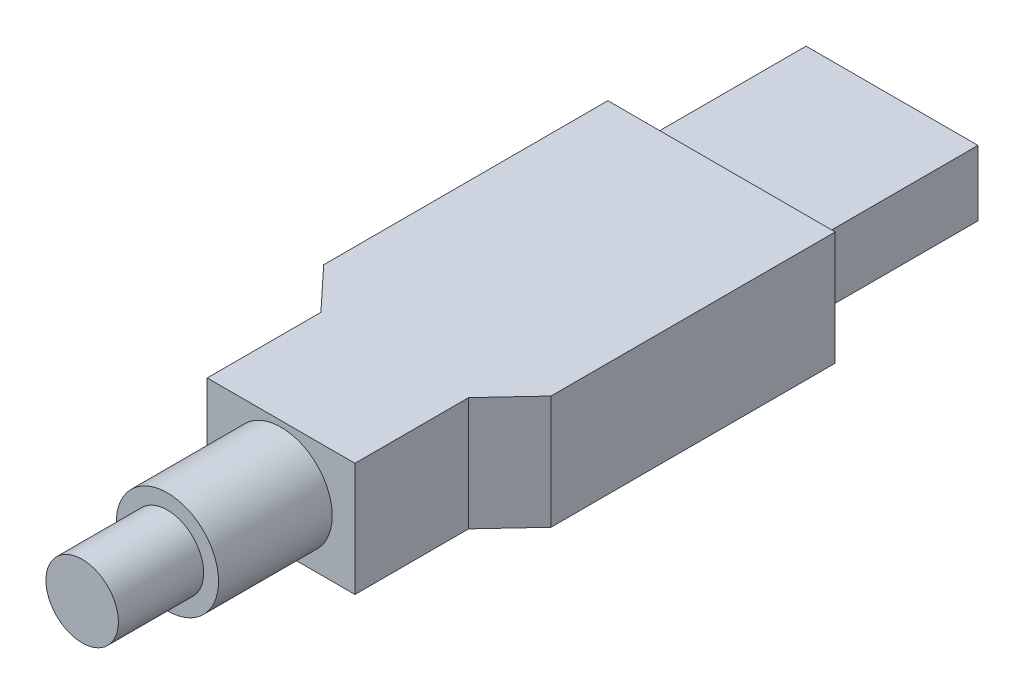
from build123d import *

# Parameters (mm, degrees)
ESQUISSE1_W             = 12.1
ESQUISSE1_H             = 4.6
BOSS_EXTRU_1_DEPTH      = 12
ESQUISSE3_W             = 11.5
ESQUISSE3_H             = 2.3
ENL_V_MAT_EXTRU_1_DEPTH = 9.6
ESQUISSE2_W             = 16
ESQUISSE2_H             = 8
BOSS_EXTRU_2_DEPTH      = 31
ENL_V_MAT_EXTRU_2_DEPTH = 45.463468151
ESQUISSE5_R             = 3.6
BOSS_EXTRU_3_DEPTH      = 8
ESQUISSE6_R             = 2.55
BOSS_EXTRU_4_DEPTH      = 6


with BuildPart() as part:
    # Esquisse1 → Boss.-Extru.1 (new body)
    with BuildSketch(Plane.XY):
        Rectangle(ESQUISSE1_W, ESQUISSE1_H)
    extrude(amount=BOSS_EXTRU_1_DEPTH)

    # Esquisse3 → Enlèv. mat.-Extru.1 (cut)
    with BuildSketch(Plane(origin=(0, 0, 0), x_dir=(-1, 0, 0), z_dir=(0, 0, -1))):
        with Locations((0, -0.85)):
            Rectangle(ESQUISSE3_W, ESQUISSE3_H)
    extrude(amount=-ENL_V_MAT_EXTRU_1_DEPTH, mode=Mode.SUBTRACT)

    # Esquisse2 → Boss.-Extru.2 (add)
    with BuildSketch(Plane.XY.offset(12)):
        Rectangle(ESQUISSE2_W, ESQUISSE2_H)
    extrude(amount=BOSS_EXTRU_2_DEPTH)

    # Esquisse4 → Enlèv. mat.-Extru.2 (cut, through all)
    with BuildSketch(Plane(origin=(0, 4, 0), x_dir=(1, 0, 0), z_dir=(0, 1, 0))):
        Polygon((-8, -43), (-8, -32), (-5.2, -35), (-5.2, -43), align=None)
        Polygon((5.2, -43), (8, -43), (8, -32), (5.2, -35), align=None)
    extrude(amount=-ENL_V_MAT_EXTRU_2_DEPTH, mode=Mode.SUBTRACT)

    # Esquisse5 → Boss.-Extru.3 (add)
    with BuildSketch(Plane.XY.offset(43)):
        Circle(ESQUISSE5_R)
    extrude(amount=BOSS_EXTRU_3_DEPTH)

    # Esquisse6 → Boss.-Extru.4 (add)
    with BuildSketch(Plane.XY.offset(51)):
        Circle(ESQUISSE6_R)
    extrude(amount=BOSS_EXTRU_4_DEPTH)


solid = part.part
